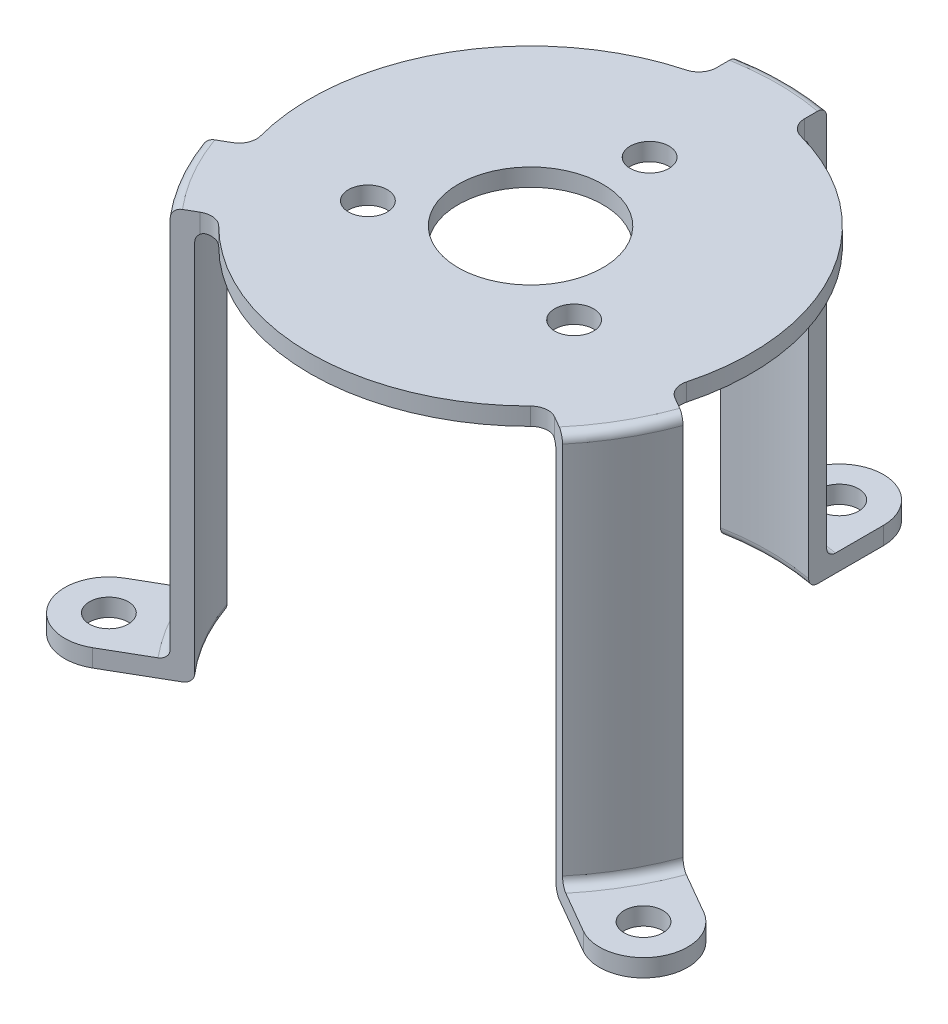
from build123d import *

# Parameters (mm, degrees)
ESBO_O1_R                = 4.1
ESBO_O1_R_2              = 1.099999999999999
ESBO_O1_R_3              = 1.1000000000000312
ESBO_O1_R_4              = 1.1000000000000612
RESSALTO_EXTRUS_O1_DEPTH = 1
RESSALTO_EXTRUS_O2_START = 22.2
RESSALTO_EXTRUS_O2_DEPTH = 22.2
ESBO_O3_R                = 1.1
ESBO_O3_R_2              = 1.100000000000001
ESBO_O3_R_3              = 1.0999999999999976
RESSALTO_EXTRUS_O3_DEPTH = 1
FILETE1_R                = 1
FILETE2_R                = 0.5
FILETE3_R                = 0.5
FILETE4_R                = 0.5
FILETE5_R                = 0.5


with BuildPart() as part:
    # Esboço1 → Ressalto-extrusão1 (new body)
    with BuildSketch(Plane(origin=(0, 0, 0), x_dir=(1, 0, 0), z_dir=(0, 1, 0))):
        with BuildLine():
            Line((-2.5000000000000018, 14.2828568570857), (-2.5000000000000004, 12.24744871391589))
            ThreePointArc((-2.5000000000000004, 12.24744871391589), (-10.825317547305453, 6.250000000000052), (-11.856601717798243, -3.9586608474967395))
            Line((-11.856601717798243, -3.9586608474967395), (-13.619316876853024, -4.976364919081628))
            ThreePointArc((-13.619316876853024, -4.976364919081628), (-12.557368354874425, -7.249999999999881), (-11.119316876853064, -9.306491938003845))
            Line((-11.119316876853064, -9.306491938003845), (-9.356601717798284, -8.288787866418957))
            ThreePointArc((-9.356601717798284, -8.288787866418957), (-8.528e-14, -12.499999999999996), (9.356601717798178, -8.288787866419089))
            Line((9.356601717798178, -8.288787866419089), (11.119316876852942, -9.306491938004001))
            ThreePointArc((11.119316876852942, -9.306491938004001), (12.55736835487433, -7.250000000000061), (13.619316876852963, -4.976364919081819))
            Line((13.619316876852963, -4.976364919081819), (11.856601717798197, -3.958660847496907))
            ThreePointArc((11.856601717798197, -3.958660847496907), (10.8253175473055, 6.249999999999976), (2.499999999999998, 12.24744871391589))
            Line((2.499999999999998, 12.24744871391589), (2.4999999999999982, 14.2828568570857))
            ThreePointArc((2.4999999999999982, 14.2828568570857), (8.9e-16, 14.5), (-2.5000000000000018, 14.2828568570857))
        make_face()
        with Locations(Location((0, 0, 0), (0, 0, 270))):
            Circle(ESBO_O1_R, mode=Mode.SUBTRACT)
        with Locations(Location((0, 6.750000000000001, 0), (0, 0, 270))):
            Circle(ESBO_O1_R_2, mode=Mode.SUBTRACT)
        with Locations(Location((5.845671475544961, -3.374999999999999, 0), (0, 0, 270))):
            Circle(ESBO_O1_R_3, mode=Mode.SUBTRACT)
        with Locations(Location((-5.84567147554496, -3.3750000000000036, 0), (0, 0, 270))):
            Circle(ESBO_O1_R_4, mode=Mode.SUBTRACT)
    extrude(amount=RESSALTO_EXTRUS_O1_DEPTH)

    # Esboço2 → Ressalto-extrusão2 (add)
    with BuildSketch(Plane.XZ.offset(RESSALTO_EXTRUS_O2_START)):
        with BuildLine():
            Line((-11.11931687685307, 9.30649193800384), (-10.239125293076137, 8.798313090171801))
            ThreePointArc((-10.239125293076137, 8.798313090171801), (-11.691342951089984, 6.74999999999989), (-12.739125293076098, 4.4681860712495824))
            Line((-12.739125293076098, 4.4681860712495824), (-13.619316876853024, 4.976364919081628))
            ThreePointArc((-13.619316876853024, 4.976364919081628), (-12.557368354874427, 7.249999999999882), (-11.11931687685307, 9.30649193800384))
        make_face()
        with BuildLine():
            Line((-2.5000000000000018, -14.2828568570857), (-2.5000000000000013, -13.266499161421601))
            ThreePointArc((-2.5000000000000013, -13.266499161421601), (-2.17e-15, -13.500000000000002), (2.499999999999998, -13.266499161421601))
            Line((2.499999999999998, -13.266499161421601), (2.4999999999999982, -14.2828568570857))
            ThreePointArc((2.4999999999999982, -14.2828568570857), (8.9e-16, -14.500000000000002), (-2.5000000000000018, -14.2828568570857))
        make_face()
        with BuildLine():
            Line((13.619316876852963, 4.976364919081819), (12.739125293076041, 4.468186071249766))
            ThreePointArc((12.739125293076041, 4.468186071249766), (11.691342951089894, 6.750000000000058), (10.239125293076022, 8.798313090171948))
            Line((10.239125293076022, 8.798313090171948), (11.119316876852942, 9.306491938004001))
            ThreePointArc((11.119316876852942, 9.306491938004001), (12.557368354874331, 7.250000000000062), (13.619316876852963, 4.976364919081819))
        make_face()
    extrude(amount=-RESSALTO_EXTRUS_O2_DEPTH)

    # Esboço3 → Ressalto-extrusão3 (add)
    # profile 1 of 3: a face of its own
    with BuildSketch(Plane.XZ.offset(22.2)):
        with BuildLine():
            Line((2.4999999999999982, -14.2828568570857), (2.4999999999999982, -17.5))
            ThreePointArc((2.4999999999999982, -17.5), (-1.99e-15, -20), (-2.500000000000002, -17.5))
            Line((-2.500000000000002, -17.5), (-2.5000000000000018, -14.2828568570857))
            ThreePointArc((-2.5000000000000018, -14.2828568570857), (8.9e-16, -14.500000000000002), (2.4999999999999982, -14.2828568570857))
        make_face()
        with Locations(Location((-1.53e-15, -17.5, 0), (0, 0, 270))):
            Circle(ESBO_O3_R, mode=Mode.SUBTRACT)
    # profile 2 of 3: a face of its own
    with BuildSketch(Plane.XZ.offset(22.2)):
        with BuildLine():
            Line((-11.11931687685294, 9.306491938004003), (-13.905444566227628, 10.915063509461165))
            ThreePointArc((-13.905444566227628, 10.915063509461165), (-17.320508075688732, 10.000000000000085), (-16.40544456622765, 6.584936490538983))
            Line((-16.40544456622765, 6.584936490538983), (-13.619316876852961, 4.97636491908182))
            ThreePointArc((-13.619316876852961, 4.97636491908182), (-12.55736835487433, 7.250000000000063), (-11.11931687685294, 9.306491938004003))
        make_face()
        with Locations(Location((-15.15544456622764, 8.750000000000073, 0), (0, 0, 270))):
            Circle(ESBO_O3_R_2, mode=Mode.SUBTRACT)
    # profile 3 of 3: a face of its own
    with BuildSketch(Plane.XZ.offset(22.2)):
        with BuildLine():
            Line((13.619316876853029, 4.976364919081625), (16.40544456622774, 6.58493649053875))
            ThreePointArc((16.40544456622774, 6.58493649053875), (17.320508075688867, 9.999999999999838), (13.905444566227779, 10.915063509460968))
            Line((13.905444566227779, 10.915063509460968), (11.11931687685307, 9.306491938003841))
            ThreePointArc((11.11931687685307, 9.306491938003841), (12.557368354874429, 7.249999999999881), (13.619316876853029, 4.976364919081625))
        make_face()
        with Locations(Location((15.155444566227757, 8.749999999999858, 0), (0, 0, 270))):
            Circle(ESBO_O3_R_3, mode=Mode.SUBTRACT)
    extrude(amount=-RESSALTO_EXTRUS_O3_DEPTH)

    # Filete1
    filete1_edges = [part.edges().sort_by_distance(p)[0] for p in [
        (11.856601717798199, 0.5, 3.9586608474969074),
        (2.4999999999999982, 0.5, -12.24744871391589),
        (-2.5000000000000004, 0.5, -12.24744871391589),
        (-11.856601717798242, 0.5, 3.9586608474967386),
        (9.356601717798178, 0.5, 8.288787866419089),
        (-9.356601717798284, 0.5, 8.288787866418957),
    ]]
    fillet(filete1_edges, radius=FILETE1_R)

    # Filete2
    filete2_edges = [part.edges().sort_by_distance(p)[0] for p in [
        (-12.557368354874423, 1, 7.2499999999998845),
        (12.557368354874328, 1, 7.250000000000058),
        (-2.33e-15, 1, -14.5),
    ]]
    fillet(filete2_edges, radius=FILETE2_R)

    # Filete3
    filete3_edges = [part.edges().sort_by_distance(p)[0] for p in [
        (-1.67e-15, 0, -13.499999999999998),
        (11.691342951089894, 0, 6.750000000000058),
        (-11.691342951089982, 0, 6.749999999999892),
    ]]
    fillet(filete3_edges, radius=FILETE3_R)

    # Filete4
    filete4_edges = [part.edges().sort_by_distance(p)[0] for p in [
        (-12.557368354874328, -21.2, 7.250000000000062),
        (12.55736835487443, -21.2, 7.249999999999882),
        (-1.67e-15, -21.2, -14.500000000000004),
    ]]
    fillet(filete4_edges, radius=FILETE4_R)

    # Filete5
    filete5_edges = [part.edges().sort_by_distance(p)[0] for p in [
        (-1.67e-15, -22.2, -13.499999999999998),
        (-11.691342951089982, -22.2, 6.749999999999892),
        (11.691342951089894, -22.2, 6.750000000000058),
    ]]
    fillet(filete5_edges, radius=FILETE5_R)


solid = part.part
